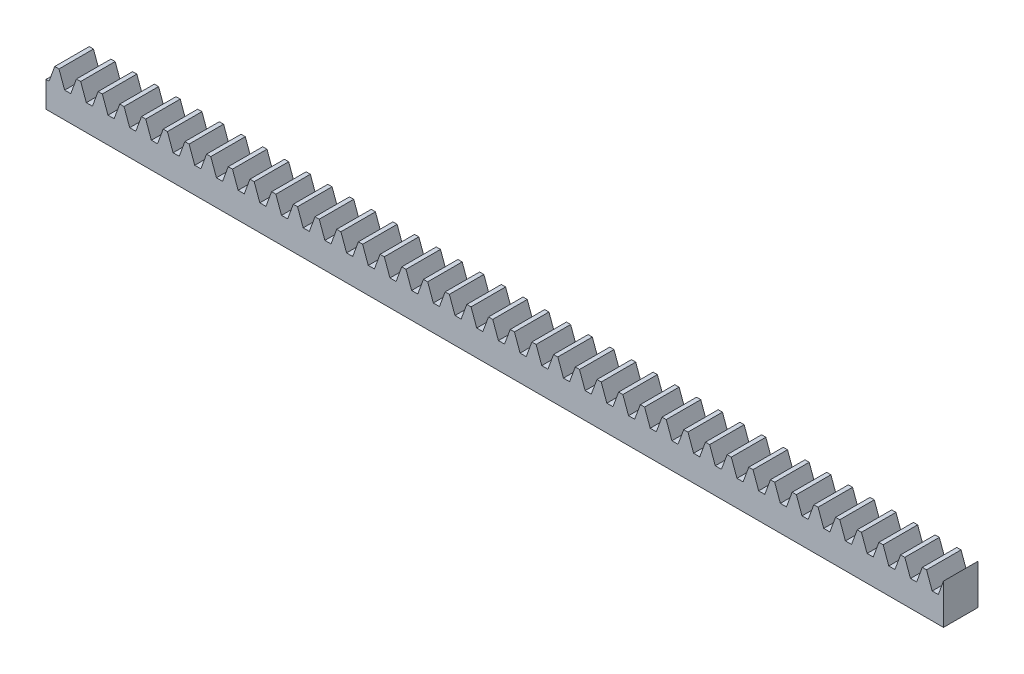
from build123d import *

# Parameters (mm, degrees)
BLANKSKE_W        = 130
BLANKSKE_H        = 6
BLANK_DEPTH       = 5
TOOTHCUTSIM_DEPTH = 131.234404057
TEETHCUTS_COUNT   = 42
TEETHCUTS_PITCH   = 3.14159265


with BuildPart() as part:
    # BlankSke → Blank (new body)
    with BuildSketch(Plane.XY):
        with Locations((65, 3)):
            Rectangle(BLANKSKE_W, BLANKSKE_H)
    extrude(amount=-BLANK_DEPTH)

    # TooCutSkeSim → ToothCutSim (cut, through all)
    with BuildSketch(Plane.XY):
        Polygon((0.44443537, 3.75), (-0.44443537, 3.75), (-1.272613241, 6.0254), (1.272613241, 6.0254), align=None)
    toothcutsim = extrude(amount=-TOOTHCUTSIM_DEPTH, mode=Mode.SUBTRACT)

    # TeethCuts: ToothCutSim ×42
    with Locations(*[(i * TEETHCUTS_PITCH, 0, 0) for i in range(1, TEETHCUTS_COUNT)]):
        add(toothcutsim, mode=Mode.SUBTRACT)


solid = part.part
